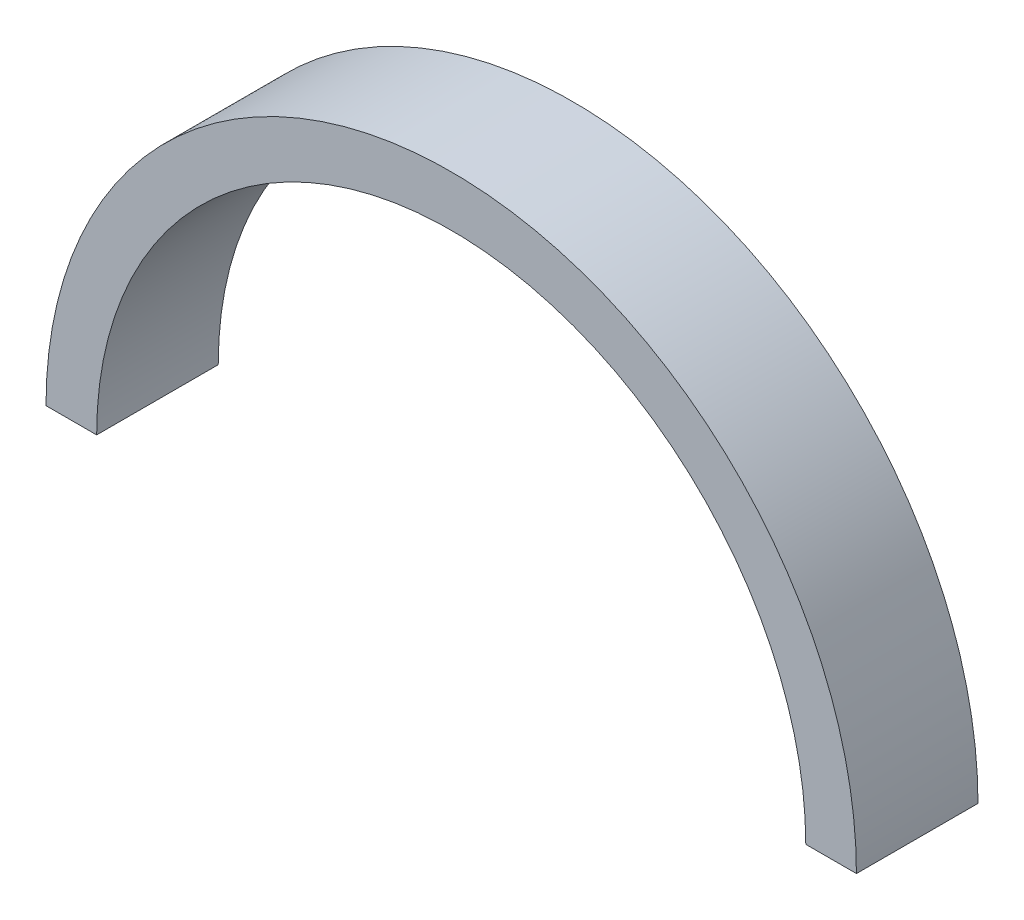
from build123d import *

# Parameters (mm, degrees)
EXTRUDE_THIN1_DEPTH = 24


with BuildPart() as part:
    # Sketch1 → Extrude-Thin1 (new body)
    with BuildSketch(Plane.XY):
        with BuildLine():
            ThreePointArc((-80, 0), (0, 80), (80, 0))
            Line((80, 0), (70, 0))
            ThreePointArc((70, 0), (0, 70), (-70, 0))
            Line((-70, 0), (-80, 0))
        make_face()
    extrude(amount=EXTRUDE_THIN1_DEPTH)


solid = part.part
